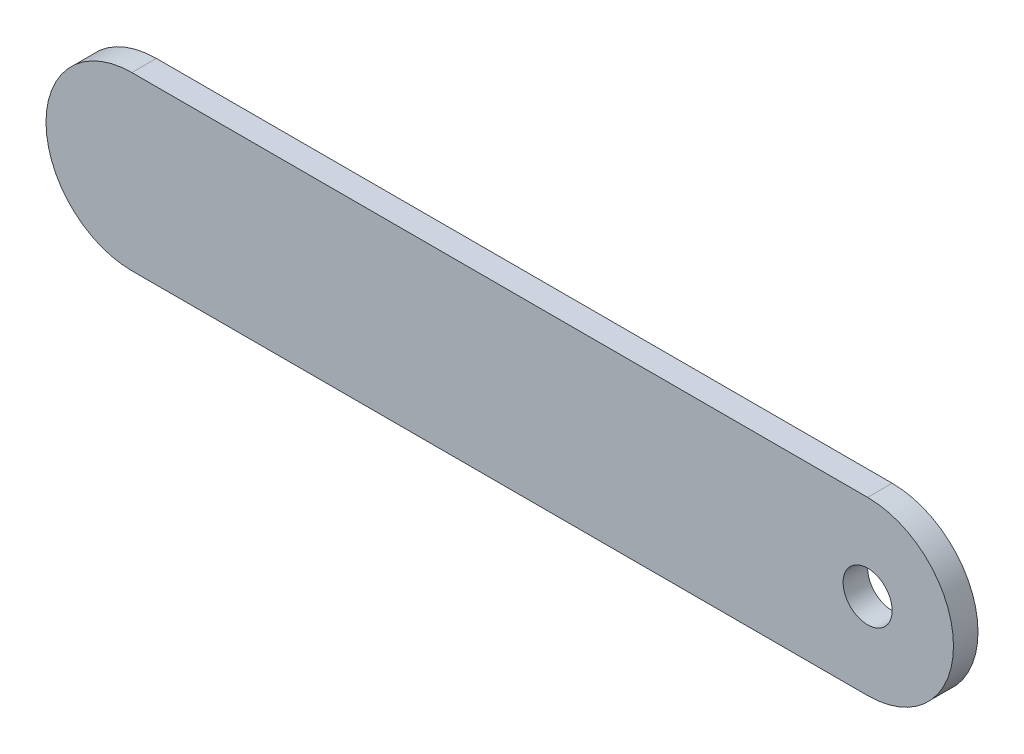
from build123d import *

# Parameters (mm, degrees)
SKETCH1_R           = 2
BOSS_EXTRUDE1_DEPTH = 2


with BuildPart() as part:
    # Sketch1 → Boss-Extrude1 (new body)
    with BuildSketch(Plane.XY):
        with BuildLine():
            Line((-43.857431375, 7), (16.142568625, 7))
            ThreePointArc((16.142568625, 7), (23.142568625, 0), (16.142568625, -7))
            Line((16.142568625, -7), (-43.857431375, -7))
            ThreePointArc((-43.857431375, -7), (-50.857431375, 0), (-43.857431375, 7))
        make_face()
        with Locations((16.142568625, 0)):
            Circle(SKETCH1_R, mode=Mode.SUBTRACT)
    extrude(amount=BOSS_EXTRUDE1_DEPTH)


solid = part.part
